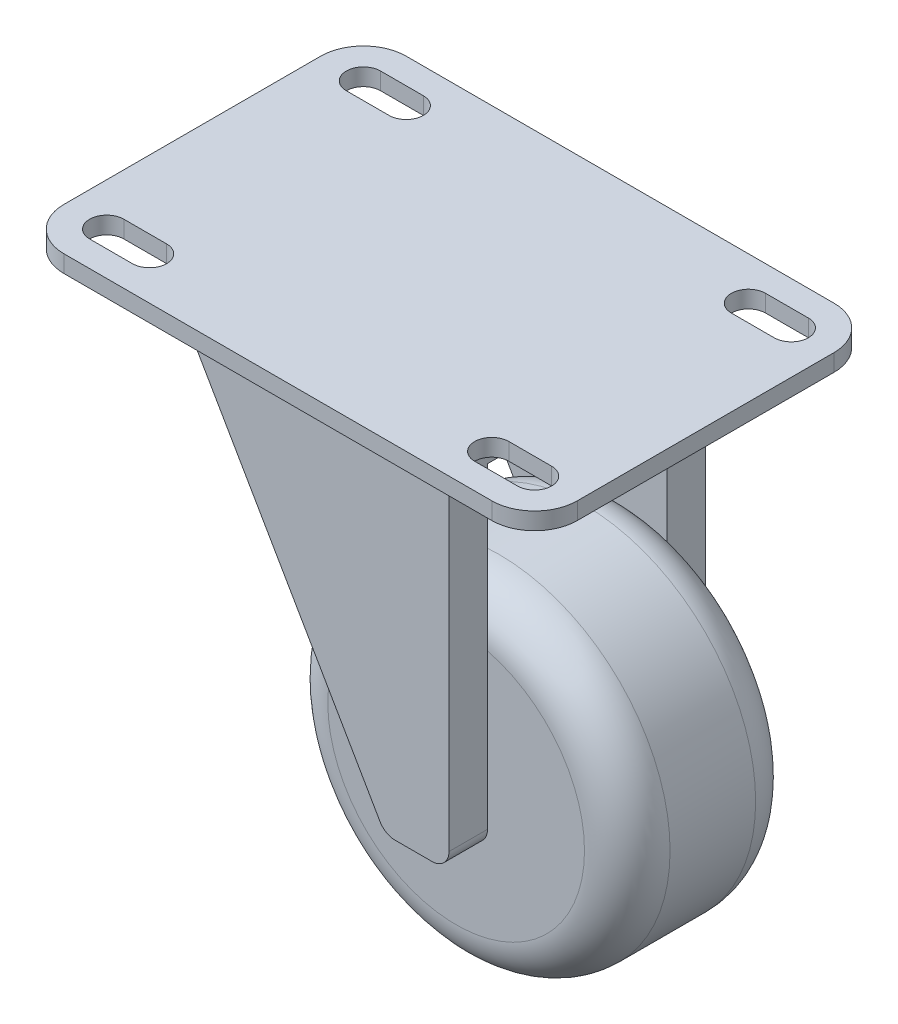
from build123d import *

# Parameters (mm, degrees)
BOSS_EXTRUDE1_DEPTH = 2
CUT_EXTRUDE1_DEPTH  = 2
SKETCH3_R           = 12
BOSS_EXTRUDE2_DEPTH = 2
SKETCH4_W           = 30
SKETCH4_H           = 30
BOSS_EXTRUDE3_DEPTH = 2
SKETCH5_R           = 2
BOSS_EXTRUDE4_DEPTH = 4.5
SKETCH6_R           = 2
BOSS_EXTRUDE5_DEPTH = 30
SKETCH7_R           = 20
BOSS_EXTRUDE6_DEPTH = 10
FILLET1_R           = 5


with BuildPart() as part:
    # Sketch1 → Boss-Extrude1 (new body)
    with BuildSketch(Plane(origin=(0, 0, 0), x_dir=(1, 0, 0), z_dir=(0, 1, 0))):
        with BuildLine():
            Line((25, -20), (-25, -20))
            ThreePointArc((-25, -20), (-28.535533906, -18.535533906), (-30, -15))
            Line((-30, -15), (-30, 15))
            ThreePointArc((-30, 15), (-28.535533906, 18.535533906), (-25, 20))
            Line((-25, 20), (25, 20))
            ThreePointArc((25, 20), (28.535533906, 18.535533906), (30, 15))
            Line((30, 15), (30, -15))
            ThreePointArc((30, -15), (28.535533906, -18.535533906), (25, -20))
        make_face()
    extrude(amount=BOSS_EXTRUDE1_DEPTH)

    # Sketch2 → Cut-Extrude1 (cut)
    with BuildSketch(Plane(origin=(0, 2, 0), x_dir=(1, 0, 0), z_dir=(0, 1, 0))):
        with BuildLine():
            Line((-25, 17), (-20, 17))
            ThreePointArc((-20, 17), (-18, 15), (-20, 13))
            Line((-20, 13), (-25, 13))
            ThreePointArc((-25, 13), (-27, 15), (-25, 17))
        make_face()
        with BuildLine():
            Line((25, 17), (20, 17))
            ThreePointArc((20, 17), (18, 15), (20, 13))
            Line((20, 13), (25, 13))
            ThreePointArc((25, 13), (27, 15), (25, 17))
        make_face()
        with BuildLine():
            Line((25, -17), (20, -17))
            ThreePointArc((20, -17), (18, -15), (20, -13))
            Line((20, -13), (25, -13))
            ThreePointArc((25, -13), (27, -15), (25, -17))
        make_face()
        with BuildLine():
            Line((-25, -17), (-20, -17))
            ThreePointArc((-20, -17), (-18, -15), (-20, -13))
            Line((-20, -13), (-25, -13))
            ThreePointArc((-25, -13), (-27, -15), (-25, -17))
        make_face()
    extrude(amount=-CUT_EXTRUDE1_DEPTH, mode=Mode.SUBTRACT)

    # Sketch3 → Boss-Extrude2 (add)
    with BuildSketch(Plane.XZ):
        with Locations(Location((0, 0, 0), (0, 0, 270))):
            Circle(SKETCH3_R)
    extrude(amount=BOSS_EXTRUDE2_DEPTH)

    # Sketch4 → Boss-Extrude3 (add)
    with BuildSketch(Plane.XZ.offset(2)):
        Rectangle(SKETCH4_W, SKETCH4_H)
    extrude(amount=BOSS_EXTRUDE3_DEPTH)

    # Sketch5 → Boss-Extrude4 (add)
    with BuildSketch(Plane.XY.offset(15)):
        with BuildLine():
            Line((-15, -4), (6.939310229, -42))
            ThreePointArc((6.939310229, -42), (7.671361037, -42.732050808), (8.671361037, -43))
            Line((8.671361037, -43), (13, -43))
            ThreePointArc((13, -43), (14.414213562, -42.414213562), (15, -41))
            Line((15, -41), (15, -4))
            Line((15, -4), (-15, -4))
        make_face()
        with Locations((10.835680518, -38)):
            Circle(SKETCH5_R, mode=Mode.SUBTRACT)
    boss_extrude4 = extrude(amount=-BOSS_EXTRUDE4_DEPTH)

    # Mirror1: Boss-Extrude4 across plane
    add(boss_extrude4.mirror(Plane.XY))

    # Sketch6 → Boss-Extrude5 (add)
    with BuildSketch(Plane.XY.offset(15)):
        with Locations((10.835680518, -38)):
            Circle(SKETCH6_R)
    extrude(amount=-BOSS_EXTRUDE5_DEPTH)

    # Sketch7 → Boss-Extrude6 (add, symmetric)
    with BuildSketch(Plane.XY):
        with Locations((10.835680518, -38)):
            Circle(SKETCH7_R)
    extrude(amount=BOSS_EXTRUDE6_DEPTH, both=True)

    # Fillet1
    fillet1_edges = [part.edges().sort_by_distance(p)[0] for p in [
        (-9.164319482, -38, -10),
        (-9.164319482, -38, 10),
    ]]
    fillet(fillet1_edges, radius=FILLET1_R)


solid = part.part
